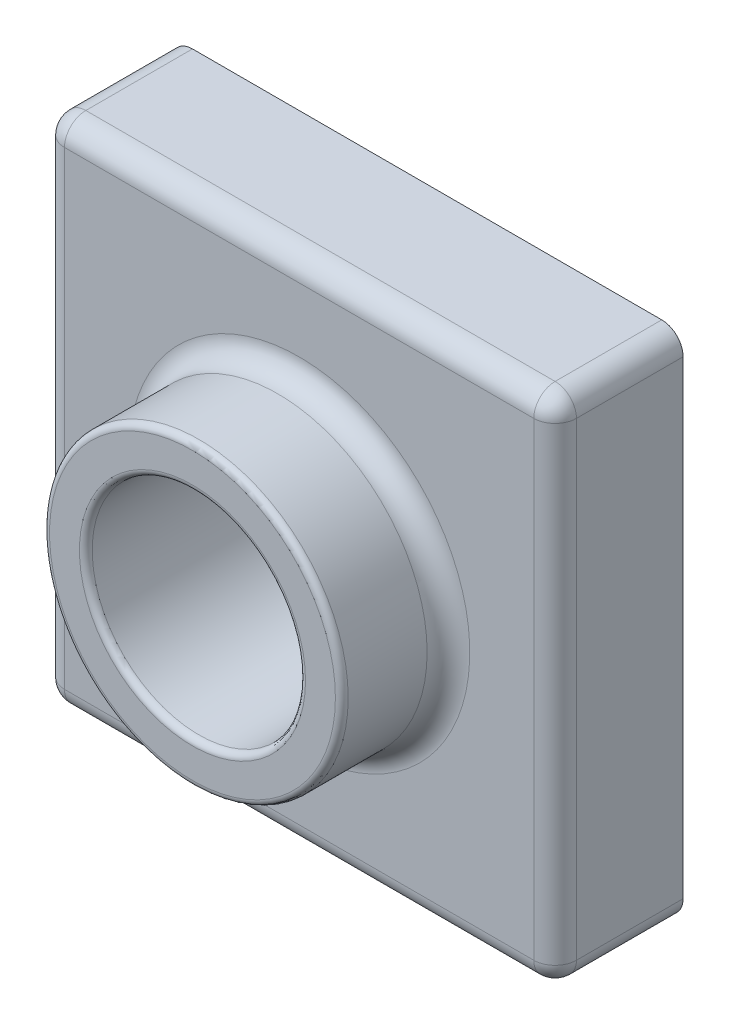
from build123d import *

# Parameters (mm, degrees)
SKETCH2_W           = 120
SKETCH2_H           = 120
BOSS_EXTRUDE1_DEPTH = 30
SKETCH3_R           = 35
BOSS_EXTRUDE2_DEPTH = 25
SKETCH4_R           = 25
CUT_EXTRUDE1_DEPTH  = 179.395627749
FILLET2_R           = 5
FILLET3_R           = 1.5
SHELL1_T            = -2


with BuildPart() as part:
    # Sketch2 → Boss-Extrude1 (new body)
    with BuildSketch(Plane.XY):
        with Locations((60, 60)):
            Rectangle(SKETCH2_W, SKETCH2_H)
    extrude(amount=BOSS_EXTRUDE1_DEPTH)

    # Sketch3 → Boss-Extrude2 (add)
    with BuildSketch(Plane.XY.offset(30)):
        with Locations(Location((60, 60, 0), (0, 0, 180))):
            Circle(SKETCH3_R)
    extrude(amount=BOSS_EXTRUDE2_DEPTH)

    # Sketch4 → Cut-Extrude1 (cut, through all)
    with BuildSketch(Plane.XY.offset(55)):
        with Locations((60, 60)):
            Circle(SKETCH4_R)
    extrude(amount=-CUT_EXTRUDE1_DEPTH, mode=Mode.SUBTRACT)

    # Fillet2
    fillet2_edges = [part.edges().sort_by_distance(p)[0] for p in [
        (120, 60, 30),
        (60, 120, 30),
        (95, 60, 30),
        (0, 60, 30),
        (60, 0, 30),
        (0, 120, 15),
        (120, 120, 15),
        (120, 0, 15),
        (0, 0, 15),
    ]]
    fillet(fillet2_edges, radius=FILLET2_R)

    # Fillet3
    fillet3_edges = [part.edges().sort_by_distance(p)[0] for p in [
        (95, 60, 55),
        (35, 60, 55),
    ]]
    fillet(fillet3_edges, radius=FILLET3_R)

    # Shell1
    shell1_openings = [part.faces().sort_by_distance(p)[0] for p in [
        (60, 1.697056275, 0),
    ]]
    offset(amount=SHELL1_T, openings=shell1_openings, kind=Kind.INTERSECTION)


solid = part.part
